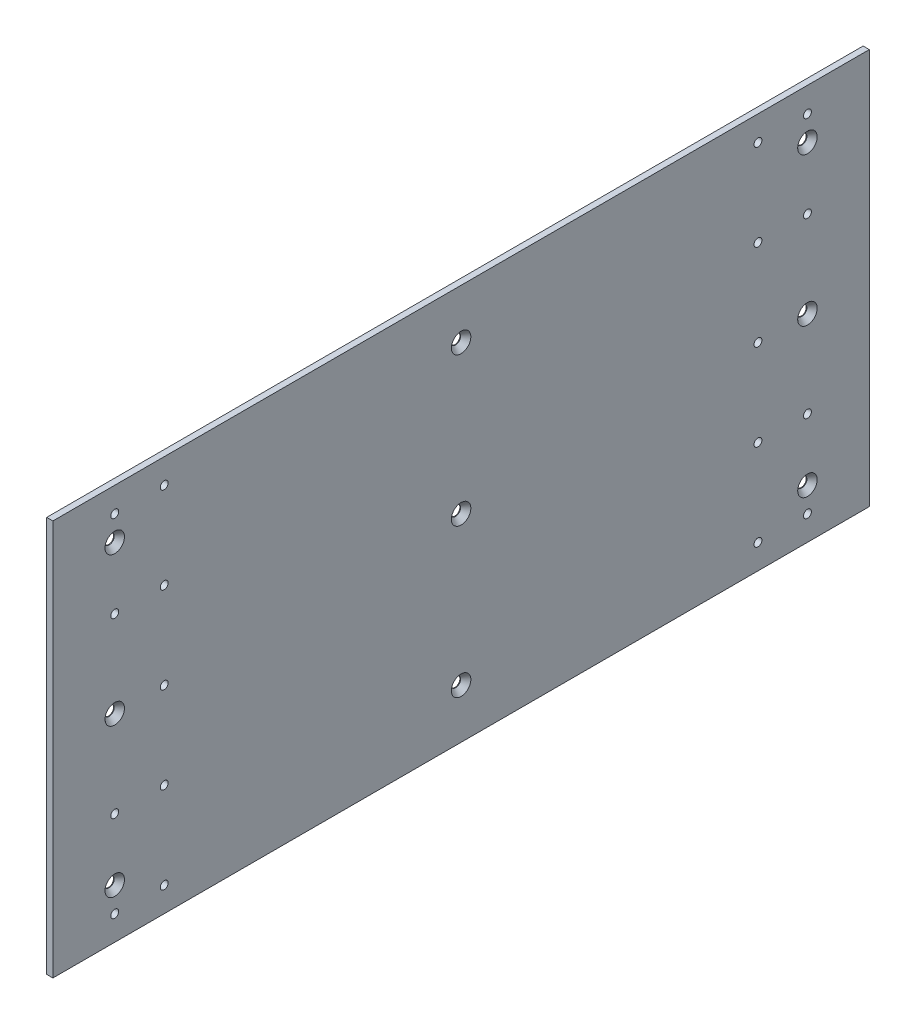
from build123d import *

# Parameters (mm, degrees)
SKETCH1_W                                    = 419.1
SKETCH1_H                                    = 203.2
BOSS_EXTRUDE1_DEPTH                          = 3.175
CSK_FOR_10_FLAT_HEAD_MACHINE_SCREW1_AT_COUNT = 2
CSK_FOR_10_FLAT_HEAD_MACHINE_SCREW1_AT_PITCH = 76.2
CSK_FOR_10_FLAT_HEAD_MACHINE_SCREW1_2_COUNT  = 2
CSK_FOR_10_FLAT_HEAD_MACHINE_SCREW1_2_PITCH  = 152.4
CSK_FOR_10_FLAT_HEAD_MACHINE_SCREW1_3_COUNT  = 2
CSK_FOR_10_FLAT_HEAD_MACHINE_SCREW1_3_PITCH  = 177.8
CSK_FOR_10_FLAT_HEAD_MACHINE_SCREW1_4_COUNT  = 2
CSK_FOR_10_FLAT_HEAD_MACHINE_SCREW1_4_PITCH  = 193.440636889
CSK_FOR_10_FLAT_HEAD_MACHINE_SCREW1_5_COUNT  = 2
CSK_FOR_10_FLAT_HEAD_MACHINE_SCREW1_5_PITCH  = 234.176429215
CSK_FOR_10_FLAT_HEAD_MACHINE_SCREW1_6_COUNT  = 2
CSK_FOR_10_FLAT_HEAD_MACHINE_SCREW1_6_PITCH  = 363.672655007
CSK_FOR_10_FLAT_HEAD_MACHINE_SCREW1_7_COUNT  = 2
CSK_FOR_10_FLAT_HEAD_MACHINE_SCREW1_7_PITCH  = 386.881273778
F_10_32_TAPPED_HOLE1_D                       = 4.0386
F_10_32_TAPPED_HOLE1_DEPTH                   = 17.78
F_10_32_TAPPED_HOLE1_TIP                     = 1.213317848


with BuildPart() as part:
    # Sketch1 → Boss-Extrude1 (new body)
    with BuildSketch(Plane(origin=(0, 0, 0), x_dir=(0, 0, -1), z_dir=(1, 0, 0))):
        with Locations((-13.003102625, -26.930668258)):
            Rectangle(SKETCH1_W, SKETCH1_H)
    extrude(amount=BOSS_EXTRUDE1_DEPTH)

    # Sketch6 → CSK for #10 Flat Head Machine Screw1 (revolve, cut)
    with BuildSketch(Plane(origin=(3.175, 49.269331742, 190.803102625), x_dir=(0, 0, -1), z_dir=(0, 1, 0))):
        Polygon((0, 0), (0, 3.175), (2.5527, 3.175), (2.5527, 2.815182832), (4.9999011, 0), align=None)
    csk_for_10_flat_head_machine_screw1 = revolve(axis=Axis((9.525, 49.269331742, 190.803102625), (-1, 0, 0)), mode=Mode.SUBTRACT)

    # CSK for #10 Flat Head Machine Screw1 at: CSK for #10 Flat Head Machine Screw1 ×2
    with Locations(*[(0, -i * CSK_FOR_10_FLAT_HEAD_MACHINE_SCREW1_AT_PITCH, 0) for i in range(1, CSK_FOR_10_FLAT_HEAD_MACHINE_SCREW1_AT_COUNT)]):
        add(csk_for_10_flat_head_machine_screw1, mode=Mode.SUBTRACT)

    # CSK for _10 Flat Head Machine Screw1 2: CSK for #10 Flat Head Machine Screw1 ×2
    with Locations(*[(0, -i * CSK_FOR_10_FLAT_HEAD_MACHINE_SCREW1_2_PITCH, 0) for i in range(1, CSK_FOR_10_FLAT_HEAD_MACHINE_SCREW1_2_COUNT)]):
        add(csk_for_10_flat_head_machine_screw1, mode=Mode.SUBTRACT)

    # CSK for _10 Flat Head Machine Screw1 3: CSK for #10 Flat Head Machine Screw1 ×2
    with Locations(*[(0, 0, -i * CSK_FOR_10_FLAT_HEAD_MACHINE_SCREW1_3_PITCH) for i in range(1, CSK_FOR_10_FLAT_HEAD_MACHINE_SCREW1_3_COUNT)]):
        add(csk_for_10_flat_head_machine_screw1, mode=Mode.SUBTRACT)

    # CSK for _10 Flat Head Machine Screw1 4: CSK for #10 Flat Head Machine Screw1 ×2
    with Locations(*[Vector(0, -0.3939192985791677, -0.9191450300180579) * (i * CSK_FOR_10_FLAT_HEAD_MACHINE_SCREW1_4_PITCH) for i in range(1, CSK_FOR_10_FLAT_HEAD_MACHINE_SCREW1_4_COUNT)]):
        add(csk_for_10_flat_head_machine_screw1, mode=Mode.SUBTRACT)

    # CSK for _10 Flat Head Machine Screw1 5: CSK for #10 Flat Head Machine Screw1 ×2
    with Locations(*[Vector(0, -0.6507913734559686, -0.7592566023652966) * (i * CSK_FOR_10_FLAT_HEAD_MACHINE_SCREW1_5_PITCH) for i in range(1, CSK_FOR_10_FLAT_HEAD_MACHINE_SCREW1_5_COUNT)]):
        add(csk_for_10_flat_head_machine_screw1, mode=Mode.SUBTRACT)

    # CSK for _10 Flat Head Machine Screw1 6: CSK for #10 Flat Head Machine Screw1 ×2
    with Locations(*[Vector(0, -0.2095290887308735, -0.9778024140774095) * (i * CSK_FOR_10_FLAT_HEAD_MACHINE_SCREW1_6_PITCH) for i in range(1, CSK_FOR_10_FLAT_HEAD_MACHINE_SCREW1_6_COUNT)]):
        add(csk_for_10_flat_head_machine_screw1, mode=Mode.SUBTRACT)

    # CSK for _10 Flat Head Machine Screw1 7: CSK for #10 Flat Head Machine Screw1 ×2
    with Locations(*[Vector(0, -0.3939192985791677, -0.9191450300180579) * (i * CSK_FOR_10_FLAT_HEAD_MACHINE_SCREW1_7_PITCH) for i in range(1, CSK_FOR_10_FLAT_HEAD_MACHINE_SCREW1_7_COUNT)]):
        add(csk_for_10_flat_head_machine_screw1, mode=Mode.SUBTRACT)

    # Sketch8 → CSK for #10 Flat Head Machine Screw2 (revolve, cut)
    with BuildSketch(Plane(origin=(3.175, 49.269331742, -164.796897375), x_dir=(0, 0, -1), z_dir=(0, 1, 0))):
        Polygon((0, 0), (0, 3.175), (2.5527, 3.175), (2.5527, 2.815182832), (4.9999011, 0), align=None)
    revolve(axis=Axis((9.525, 49.269331742, -164.796897375), (-1, 0, 0)), mode=Mode.SUBTRACT)

    # #10-32 Tapped Hole1
    with Locations(Plane(origin=(3.175, 3.54145716, 145.203510543), x_dir=(0, 0, -1), z_dir=(1, 0, 0))):
        with Locations((284.600407918, 58.427874582), (310.000407918, 58.427874582), (284.600407918, 13.977874582), (310.000407918, 13.977874582), (284.600407918, -30.472125418), (284.600407918, -74.922125418), (310.000407918, -74.922125418), (284.600407918, -119.372125418), (310.000407918, -119.372125418), (-20.199592082, 58.427874582), (-45.599592082, 58.427874582), (-20.199592082, 13.977874582), (-45.599592082, 13.977874582), (-20.199592082, -30.472125418), (-20.199592082, -74.922125418), (-45.599592082, -74.922125418), (-45.599592082, -119.372125418), (-20.199592082, -119.372125418)):
            Hole(F_10_32_TAPPED_HOLE1_D / 2, depth=F_10_32_TAPPED_HOLE1_DEPTH)
            with Locations((0, 0, -(F_10_32_TAPPED_HOLE1_DEPTH + F_10_32_TAPPED_HOLE1_TIP / 2))):  # 118° drill point
                Cone(0, F_10_32_TAPPED_HOLE1_D / 2, F_10_32_TAPPED_HOLE1_TIP, mode=Mode.SUBTRACT)


solid = part.part
